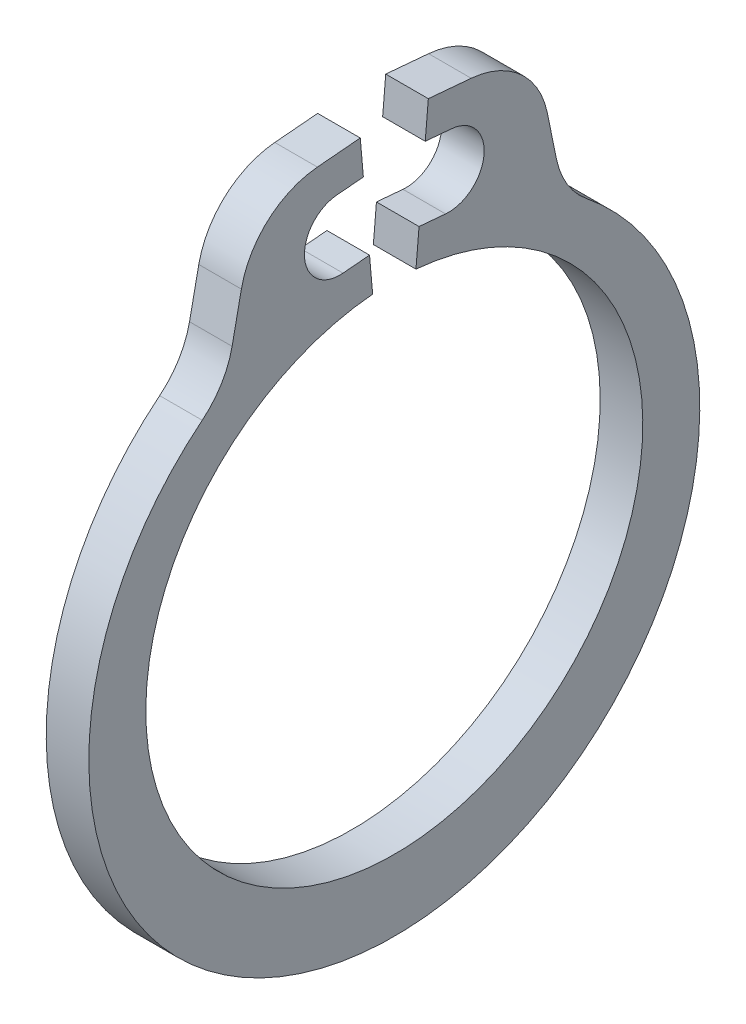
from build123d import *

# Parameters (mm, degrees)
EXTRUDE1_DEPTH = 0.1905
FILLET1_R      = 0.762


with BuildPart() as part:
    # Sketch1 → Extrude1 (new, symmetric)
    with BuildSketch(Plane(origin=(0, 0, 0), x_dir=(0, 0, -1), z_dir=(1, 0, 0))):
        with BuildLine():
            Line((0.304391432, 3.479209983), (1.253266881, 3.396194138))
            Line((1.253266881, 3.396194138), (1.509520778, 2.152315551))
            ThreePointArc((1.509520778, 2.152315551), (0, -2.8575), (-1.509520778, 2.152315551))
            Line((-1.509520778, 2.152315551), (-1.253266881, 3.396194138))
            Line((-1.253266881, 3.396194138), (-0.304391432, 3.479209983))
            Line((-0.304391432, 3.479209983), (-0.276719483, 3.162918166))
            Line((-0.276719483, 3.162918166), (-0.513938346, 3.142164205))
            ThreePointArc((-0.513938346, 3.142164205), (-0.802558214, 2.79820044), (-0.458594449, 2.509580572))
            Line((-0.458594449, 2.509580572), (-0.221375587, 2.530334533))
            Line((-0.221375587, 2.530334533), (-0.193703638, 2.214042717))
            ThreePointArc((-0.193703638, 2.214042717), (0, -2.2225), (0.193703638, 2.214042717))
            Line((0.193703638, 2.214042717), (0.221375587, 2.530334533))
            Line((0.221375587, 2.530334533), (0.458594449, 2.509580572))
            ThreePointArc((0.458594449, 2.509580572), (0.802558214, 2.79820044), (0.513938346, 3.142164205))
            Line((0.513938346, 3.142164205), (0.276719483, 3.162918166))
            Line((0.276719483, 3.162918166), (0.304391432, 3.479209983))
        make_face()
    extrude(amount=EXTRUDE1_DEPTH, both=True)

    # Fillet1
    fillet1_edges = [part.edges().sort_by_distance(p)[0] for p in [
        (0, 3.396194138, -1.253266881),
        (0, 2.152315551, -1.509520778),
        (0, 2.152315551, 1.509520778),
        (0, 3.396194138, 1.253266881),
    ]]
    fillet(fillet1_edges, radius=FILLET1_R)


solid = part.part
